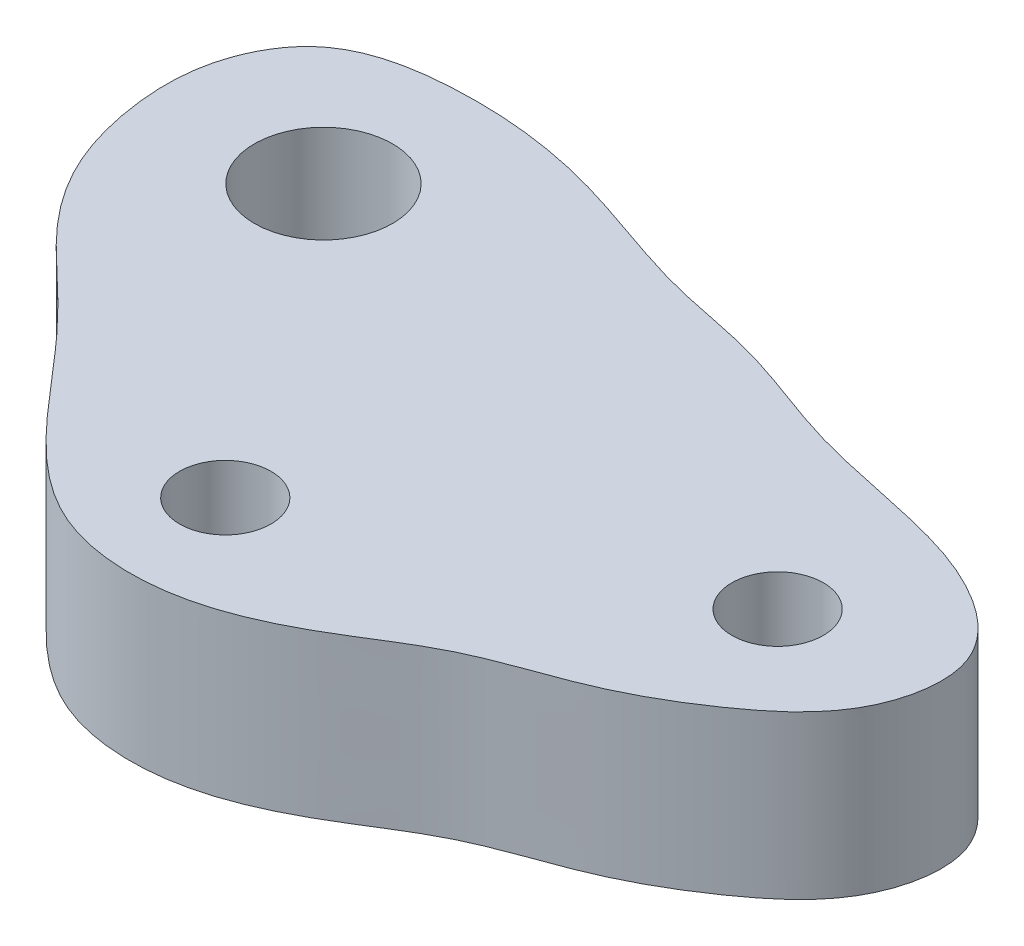
from build123d import *

# Parameters (mm, degrees)
SKETCH1_R           = 1.7
SKETCH1_R_2         = 1.125
BOSS_EXTRUDE3_DEPTH = 4


with BuildPart() as part:
    # Sketch1 → Boss-Extrude3 (new body)
    with BuildSketch(Plane(origin=(0, 0, 0), x_dir=(1, 0, 0), z_dir=(0, 1, 0))):
        with BuildLine():
            add(Edge.make_bspline(
                [(-74.30737843, 35.951013272), (-73.587038939, 35.152156232), (-72.065877642, 33.682150719), (-68.897736566, 33.471359755), (-66.398698979, 34.596879938), (-64.26451878, 36.094842655), (-61.844197021, 36.790780935), (-59.697789373, 38.033371459), (-57.845793337, 39.602895742), (-57.374119071, 42.260861107), (-59.305977928, 43.734625869), (-61.648905293, 44.481939985), (-64.305136084, 44.879608339), (-66.864343075, 46.017065753), (-69.708284754, 46.4306645), (-72.65209836, 47.693772701), (-75.908478882, 48.112277427), (-78.881757279, 47.595020387), (-79.974371088, 45.496251101), (-79.924078019, 43.546902139), (-79.384569757, 41.63207401), (-78.270128807, 40.055449677), (-76.965548821, 38.887239512), (-75.642376823, 37.534051421), (-74.842855599, 36.544857857), (-74.30737843, 35.951013272)],
                knots=[0, 0, 0, 0, 0.056083445, 0.106669447, 0.156385641, 0.198717512, 0.243598808, 0.287767023, 0.329348212, 0.369066001, 0.4100294, 0.44266417, 0.500846371, 0.550164339, 0.589406534, 0.651753107, 0.71708681, 0.76439072, 0.796650952, 0.831997761, 0.865804622, 0.900321097, 0.932192957, 0.958309374, 1, 1, 1, 1], degree=3))
        make_face()
        with Locations(Location((-75.864033859, 44.303837967, 0), (0, 0, 270))):
            Circle(SKETCH1_R, mode=Mode.SUBTRACT)
        with Locations(Location((-61.20848527, 40.824721079, 0), (0, 0, 270))):
            Circle(SKETCH1_R_2, mode=Mode.SUBTRACT)
        with Locations(Location((-70.379526687, 36.402704873, 0), (0, 0, 270))):
            Circle(SKETCH1_R_2, mode=Mode.SUBTRACT)
    extrude(amount=BOSS_EXTRUDE3_DEPTH)


solid = part.part
